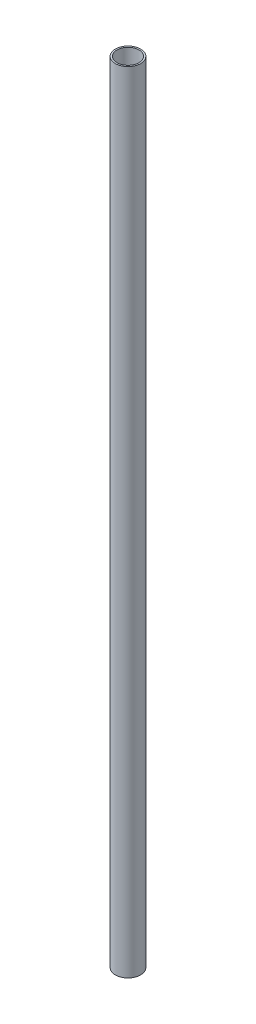
from build123d import *

# Parameters (mm, degrees)
SKETCH1_R           = 8
SKETCH1_R_2         = 7
BOSS_EXTRUDE1_DEPTH = 250


with BuildPart() as part:
    # Sketch1 → Boss-Extrude1 (new, symmetric)
    with BuildSketch(Plane(origin=(0, 0, 0), x_dir=(1, 0, 0), z_dir=(0, 1, 0))):
        with Locations(Location((0, 0, 0), (0, 0, 270))):
            Circle(SKETCH1_R)
        with Locations(Location((0, 0, 0), (0, 0, 270))):
            Circle(SKETCH1_R_2, mode=Mode.SUBTRACT)
    extrude(amount=BOSS_EXTRUDE1_DEPTH, both=True)


solid = part.part
